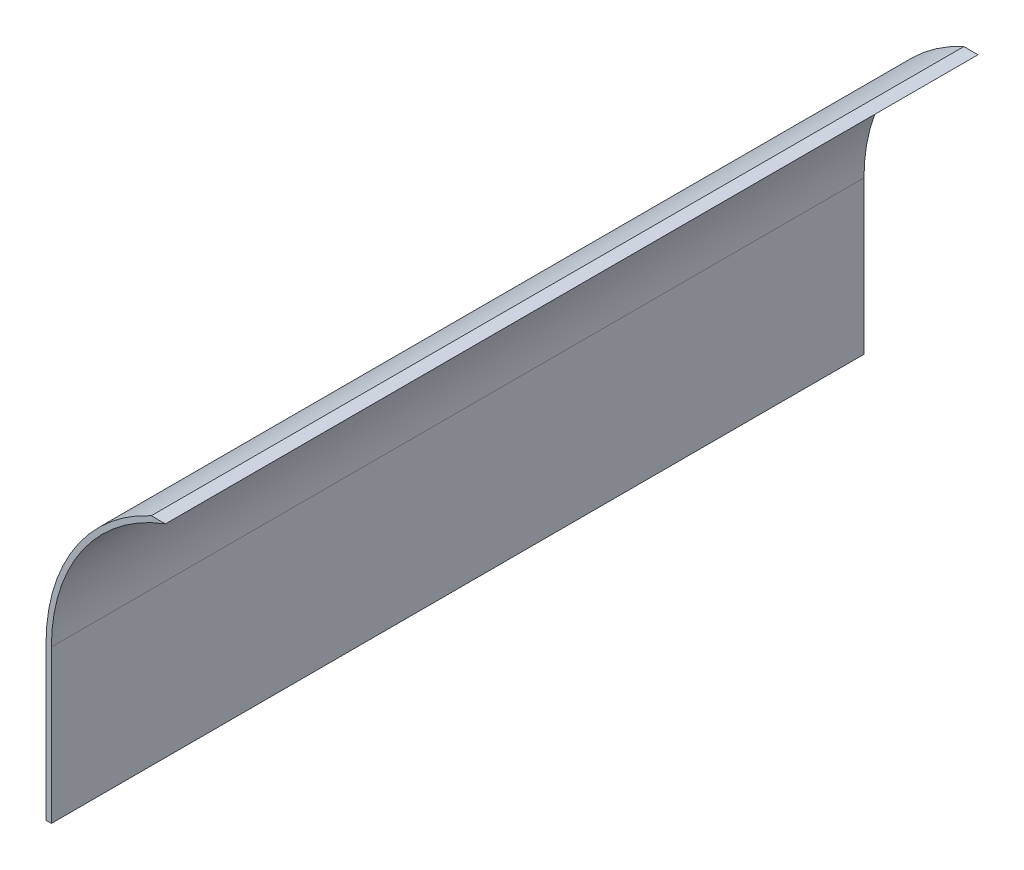
from build123d import *

# Parameters (mm, degrees)
SKETCH1_W               = 370
SKETCH1_H               = 370
BOSS_EXTRUDE1_DEPTH     = 1000
FILLET1_R               = 100
SHELL1_T                = -3
SKETCH2_W               = 241.73479806
SKETCH2_H               = 394.761154712
CUT_EXTRUDE1_DEPTH      = 2018.039910364
CUT_EXTRUDE2_DEPTH      = 1034.125839383
CUT_EXTRUDE2_DEPTH_BACK = 1034.125839383
SKETCH3_W               = 1896.128472869
SKETCH3_H               = 1300.286243779
SKETCH5_W               = 669.384629734
SKETCH5_H               = 44.432040192
SKETCH5_H_2             = 62.844566938
CUT_EXTRUDE4_DEPTH      = 1034.658550973
SKETCH4_W               = 536.60110681
SKETCH4_H               = 206.247567531
CUT_EXTRUDE5_DEPTH      = 1018.539609917


with BuildPart() as part:
    # Sketch1 → Boss-Extrude1 (new, symmetric)
    with BuildSketch(Plane.XY):
        Rectangle(SKETCH1_W, SKETCH1_H)
    extrude(amount=BOSS_EXTRUDE1_DEPTH, both=True)

    # Fillet1
    fillet1_edges = [part.edges().sort_by_distance(p)[0] for p in [
        (-185, 185, 0),
        (185, 185, 0),
        (185, -185, 0),
        (-185, -185, 0),
    ]]
    fillet(fillet1_edges, radius=FILLET1_R)

    # Shell1
    shell1_openings = [part.faces().sort_by_distance(p)[0] for p in [
        (0, 0, -1000),
    ]]
    offset(amount=SHELL1_T, openings=shell1_openings, kind=Kind.INTERSECTION)

    # Sketch2 → Cut-Extrude1 (cut, through all)
    with BuildSketch(Plane.XY.offset(1000)):
        with Locations((120.86739903, -12.380577356)):
            Rectangle(SKETCH2_W, SKETCH2_H)
    extrude(amount=-CUT_EXTRUDE1_DEPTH, mode=Mode.SUBTRACT)

    # Sketch3 → Cut-Extrude2 (cut, two sides: drawn at the far end of the back side and taken through both)
    with BuildSketch(Plane(origin=(-182, 0, 0), x_dir=(0, 0, -1), z_dir=(1, 0, 0)).offset(-CUT_EXTRUDE2_DEPTH_BACK)):
        with Locations((-400.064236435, -68.17726838)):
            Rectangle(SKETCH3_W, SKETCH3_H)
    extrude(amount=CUT_EXTRUDE2_DEPTH + CUT_EXTRUDE2_DEPTH_BACK, mode=Mode.SUBTRACT)

    # Sketch5 → Cut-Extrude4 (cut, through all)
    with BuildSketch(Plane.ZY.offset(185)):
        with Locations((-762.41238843, 198.216020096)):
            Rectangle(SKETCH5_W, SKETCH5_H)
        with Locations((-762.41238843, -207.422283469)):
            Rectangle(SKETCH5_W, SKETCH5_H_2)
    extrude(amount=-CUT_EXTRUDE4_DEPTH, mode=Mode.SUBTRACT)

    # Sketch4 → Cut-Extrude5 (cut, through all)
    with BuildSketch(Plane.ZY.offset(185)):
        with Locations((-731.699446595, -103.123783766)):
            Rectangle(SKETCH4_W, SKETCH4_H)
    extrude(amount=-CUT_EXTRUDE5_DEPTH, mode=Mode.SUBTRACT)


solid = part.part
